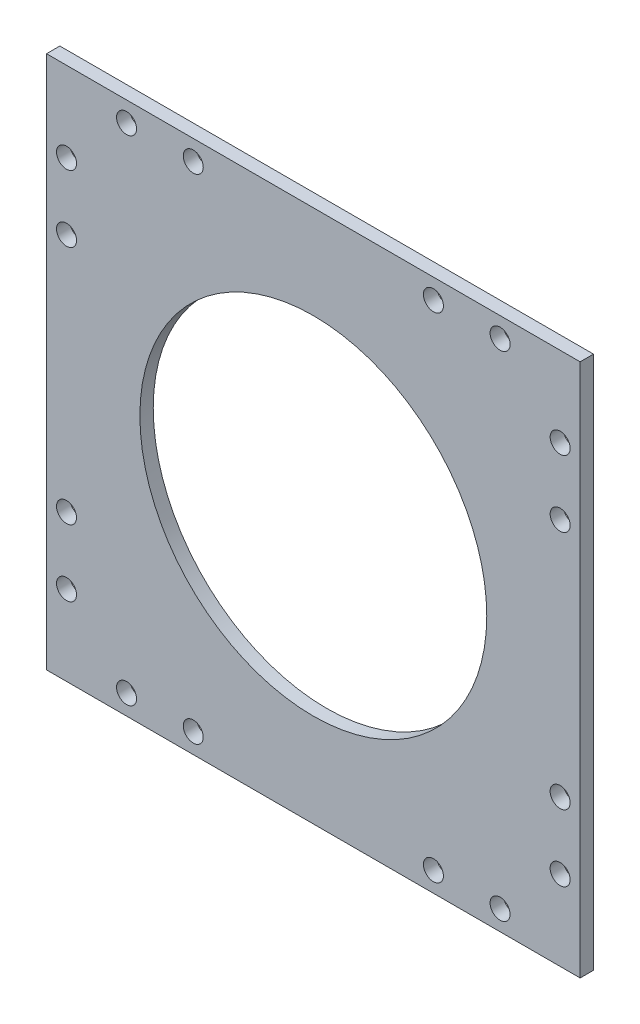
from build123d import *

# Parameters (mm, degrees)
SKETCH_1_W          = 80
SKETCH_1_H          = 80
SKETCH_1_R          = 26
EXTRUDE_1_DEPTH     = 2
SKETCH_2_R          = 1.5
CUT_EXTRUDE_1_DEPTH = 57.603886792


with BuildPart() as part:
    # 草图1 → 凸台-拉伸1 (new body)
    with BuildSketch(Plane.XY):
        Rectangle(SKETCH_1_W, SKETCH_1_H)
        Circle(SKETCH_1_R, mode=Mode.SUBTRACT)
    extrude(amount=EXTRUDE_1_DEPTH)

    # 草图2 → 切除-拉伸1 (cut, through all)
    with BuildSketch(Plane.XY.offset(2)):
        with Locations((37, 28)):
            Circle(SKETCH_2_R)
        with Locations((37, 18)):
            Circle(SKETCH_2_R)
        with Locations((37, -18)):
            Circle(SKETCH_2_R)
        with Locations((37, -28)):
            Circle(SKETCH_2_R)
        with Locations(Location((-37, -28, 0), (0, 0, 180))):
            Circle(SKETCH_2_R)
        with Locations(Location((-37, -18, 0), (0, 0, 180))):
            Circle(SKETCH_2_R)
        with Locations(Location((-37, 18, 0), (0, 0, 180))):
            Circle(SKETCH_2_R)
        with Locations(Location((-37, 28, 0), (0, 0, 180))):
            Circle(SKETCH_2_R)
        with Locations((-28, 37)):
            Circle(SKETCH_2_R)
        with Locations((-18, 37)):
            Circle(SKETCH_2_R)
        with Locations((18, 37)):
            Circle(SKETCH_2_R)
        with Locations((28, 37)):
            Circle(SKETCH_2_R)
        with Locations(Location((28, -37, 0), (0, 0, 180))):
            Circle(SKETCH_2_R)
        with Locations(Location((18, -37, 0), (0, 0, 180))):
            Circle(SKETCH_2_R)
        with Locations(Location((-18, -37, 0), (0, 0, 180))):
            Circle(SKETCH_2_R)
        with Locations(Location((-28, -37, 0), (0, 0, 180))):
            Circle(SKETCH_2_R)
    extrude(amount=-CUT_EXTRUDE_1_DEPTH, mode=Mode.SUBTRACT)


solid = part.part
